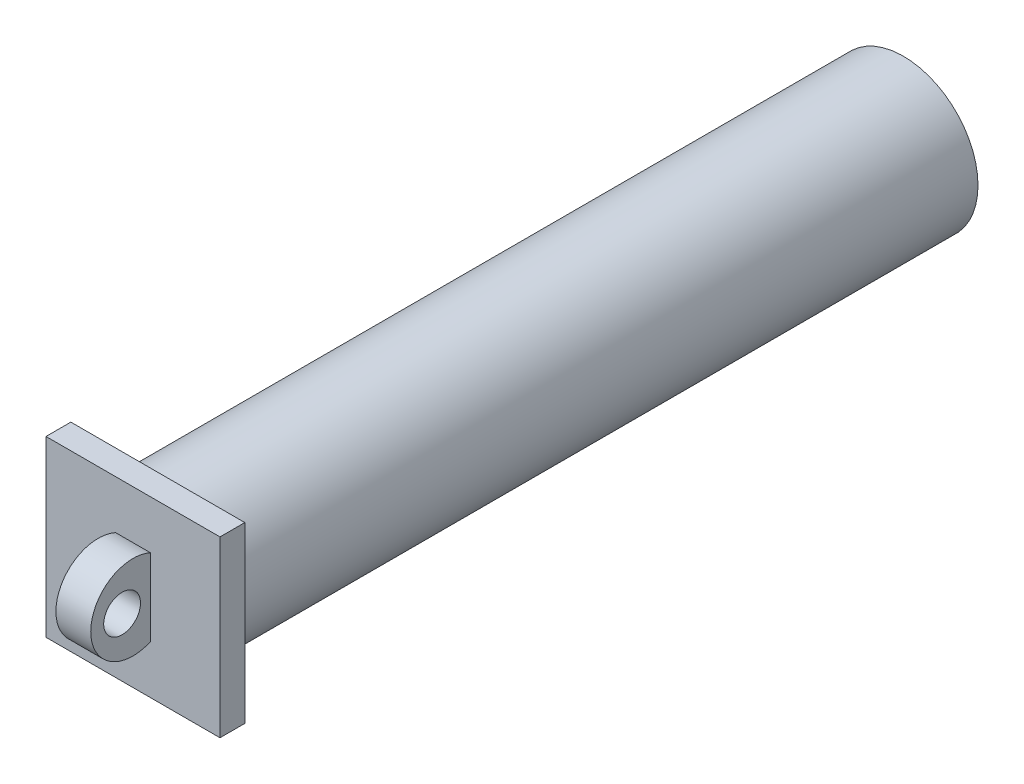
from build123d import *

# Parameters (mm, degrees)
SKETCH1_R           = 15
SKETCH1_R_2         = 10
BOSS_EXTRUDE1_DEPTH = 150
SKETCH2_W           = 35
SKETCH2_H           = 35
BOSS_EXTRUDE2_DEPTH = 5
BOSS_EXTRUDE3_DEPTH = 17.5
CUT_EXTRUDE2_REACH  = 171.222
CUT_EXTRUDE3_REACH  = 171.222
SKETCH8_R           = 3.700210901
CUT_EXTRUDE4_DEPTH  = 170.222486685


with BuildPart() as part:
    # Sketch1 → Boss-Extrude1 (new body)
    with BuildSketch(Plane.XY):
        Circle(SKETCH1_R)
        Circle(SKETCH1_R_2, mode=Mode.SUBTRACT)
    extrude(amount=BOSS_EXTRUDE1_DEPTH)

    # Sketch2 → Boss-Extrude2 (add)
    with BuildSketch(Plane.XY.offset(150)):
        Rectangle(SKETCH2_W, SKETCH2_H)
    extrude(amount=BOSS_EXTRUDE2_DEPTH)

    # Sketch3 → Boss-Extrude3 (add, symmetric)
    with BuildSketch(Plane(origin=(0, 0, 0), x_dir=(0, 0, -1), z_dir=(1, 0, 0))):
        with BuildLine():
            ThreePointArc((-155, 7.745966692), (-167, 0), (-155, -7.745966692))
            Line((-155, -7.745966692), (-155, 7.745966692))
        make_face()
        with BuildLine():
            Line((-155, 7.745966692), (-155, -7.745966692))
            ThreePointArc((-155, -7.745966692), (-151.358571571, -4.609772229), (-150, 0))
            ThreePointArc((-150, 0), (-151.358571571, 4.609772229), (-155, 7.745966692))
        make_face()
    extrude(amount=BOSS_EXTRUDE3_DEPTH, both=True)

    # Sketch5 → Cut-Extrude2 (cut, up to next)
    with BuildSketch(Plane(origin=(3.5, 0, 0), x_dir=(0, 0, -1), z_dir=(1, 0, 0)), mode=Mode.PRIVATE) as cut_extrude2_sk1:
        with BuildLine():
            Line((-155, -7.745966692), (-155, 7.745966692))
            ThreePointArc((-155, 7.745966692), (-167, 0), (-155, -7.745966692))
        make_face()
    cut_extrude2_tool1 = extrude(cut_extrude2_sk1.sketch, amount=CUT_EXTRUDE2_REACH, mode=Mode.PRIVATE) & part.part
    add(cut_extrude2_tool1.solids().sort_by_distance((3.5, 0, 160.309139))[0], mode=Mode.SUBTRACT)

    # Sketch6 → Cut-Extrude3 (cut, up to next)
    with BuildSketch(Plane(origin=(-3.5, 0, 0), x_dir=(0, 0, -1), z_dir=(1, 0, 0)), mode=Mode.PRIVATE) as cut_extrude3_sk1:
        with BuildLine():
            Line((-155, -7.745966692), (-155, 7.745966692))
            ThreePointArc((-155, 7.745966692), (-167, 0), (-155, -7.745966692))
        make_face()
    cut_extrude3_tool1 = extrude(cut_extrude3_sk1.sketch, amount=-CUT_EXTRUDE3_REACH, mode=Mode.PRIVATE) & part.part
    add(cut_extrude3_tool1.solids().sort_by_distance((-3.5, 0, 160.309139))[0], mode=Mode.SUBTRACT)

    # Sketch8 → Cut-Extrude4 (cut, through all)
    with BuildSketch(Plane(origin=(3.5, 0, 0), x_dir=(0, 0, -1), z_dir=(1, 0, 0))):
        with Locations((-160.690072365, 0)):
            Circle(SKETCH8_R)
    extrude(amount=-CUT_EXTRUDE4_DEPTH, mode=Mode.SUBTRACT)


solid = part.part
